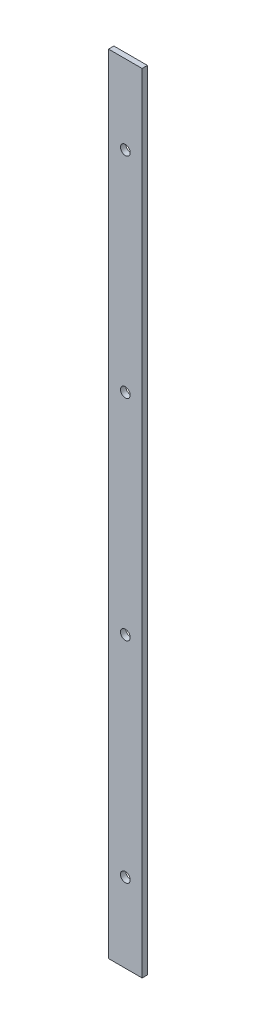
from build123d import *

# Parameters (mm, degrees)
SKETCH2_W            = 20
SKETCH2_H            = 469
BOSS_EXTRUDE1_DEPTH  = 3.175
M5_CLEARANCE_HOLE1_D = 5.8
LPATTERN1_COUNT      = 4
LPATTERN1_PITCH      = 125


with BuildPart() as part:
    # Sketch2 → Boss-Extrude1 (new body)
    with BuildSketch(Plane.XY):
        with Locations((10, 234.5)):
            Rectangle(SKETCH2_W, SKETCH2_H)
    extrude(amount=BOSS_EXTRUDE1_DEPTH)

    # M5 Clearance Hole1 (through all)
    with Locations(Plane(origin=(10, 47, 3.175), x_dir=(1, 0, 0), z_dir=(0, 0, 1))):
        with Locations((0, 0)):
            m5_clearance_hole1 = Hole(M5_CLEARANCE_HOLE1_D / 2)

    # LPattern1: M5 Clearance Hole1 ×4
    with Locations(*[(0, i * LPATTERN1_PITCH, 0) for i in range(1, LPATTERN1_COUNT)]):
        add(m5_clearance_hole1, mode=Mode.SUBTRACT)


solid = part.part
